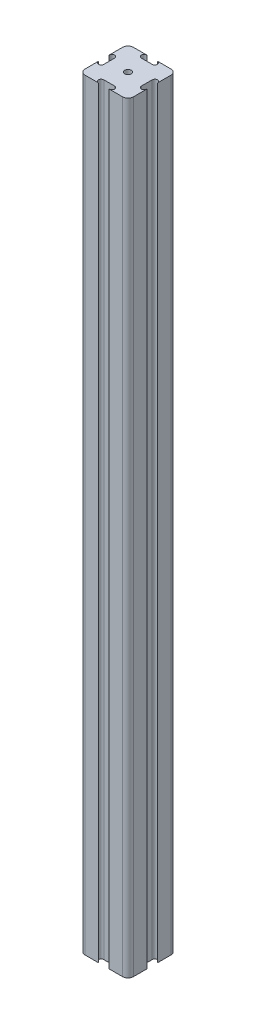
from build123d import *

# Parameters (mm, degrees)
BOSS_EXTRU_2_DEPTH      = 710
ESQUISSE5_R             = 3
ENL_V_MAT_EXTRU_1_DEPTH = 711.712670493


with BuildPart() as part:
    # Esquisse4 → Boss.-Extru.2 (new body)
    with BuildSketch(Plane(origin=(0, 0, 0), x_dir=(1, 0, 0), z_dir=(0, 1, 0))):
        with BuildLine():
            Line((-17.5, 22.5), (-5, 22.5))
            ThreePointArc((-5, 22.5), (-7.5, 20), (-5, 17.5))
            Line((-5, 17.5), (5, 17.5))
            ThreePointArc((5, 17.5), (7.5, 20), (5, 22.5))
            Line((5, 22.5), (17.5, 22.5))
            ThreePointArc((17.5, 22.5), (21.035534799, 21.035533013), (22.5, 17.499997475))
            Line((22.5, 17.499997475), (22.5, 4.999997475))
            ThreePointArc((22.5, 4.999997475), (20, 7.499997475), (17.5, 4.999997475))
            Line((17.5, 4.999997475), (17.5, -5.000002525))
            ThreePointArc((17.5, -5.000002525), (20, -7.500002525), (22.5, -5.000002525))
            Line((22.5, -5.000002525), (22.5, -17.500002525))
            ThreePointArc((22.5, -17.500002525), (21.035533013, -21.035534799), (17.5, -22.5))
            Line((17.5, -22.5), (5, -22.5))
            ThreePointArc((5, -22.5), (7.5, -20), (5, -17.5))
            Line((5, -17.5), (-5, -17.5))
            ThreePointArc((-5, -17.5), (-7.5, -20), (-5, -22.5))
            Line((-5, -22.5), (-17.5, -22.5))
            ThreePointArc((-17.5, -22.5), (-21.035533906, -21.035533906), (-22.5, -17.5))
            Line((-22.5, -17.5), (-22.5, -5))
            ThreePointArc((-22.5, -5), (-20, -7.5), (-17.5, -5))
            Line((-17.5, -5), (-17.5, 5))
            ThreePointArc((-17.5, 5), (-20, 7.5), (-22.5, 5))
            Line((-22.5, 5), (-22.5, 17.5))
            ThreePointArc((-22.5, 17.5), (-21.035533906, 21.035533906), (-17.5, 22.5))
        make_face()
    extrude(amount=BOSS_EXTRU_2_DEPTH)

    # Esquisse5 → Enlèv. mat.-Extru.1 (cut, through all)
    with BuildSketch(Plane.XZ):
        with Locations(Location((0, 0, 0), (0, 0, 270))):
            Circle(ESQUISSE5_R)
    extrude(amount=-ENL_V_MAT_EXTRU_1_DEPTH, mode=Mode.SUBTRACT)


solid = part.part
